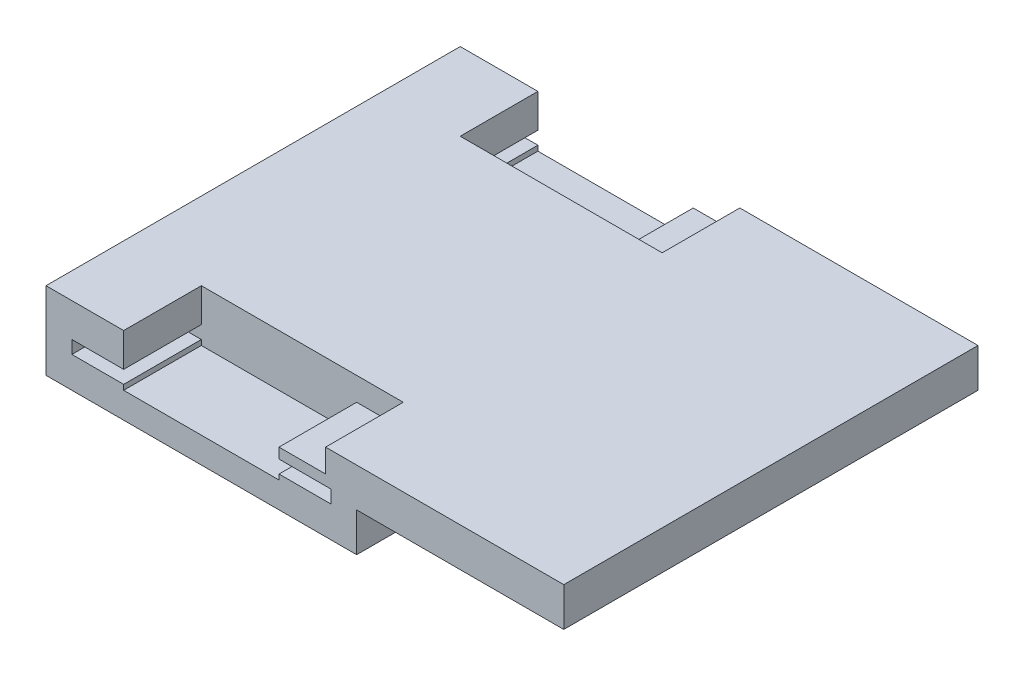
from build123d import *

# Parameters (mm, degrees)
SKETCH1_W               = 320
SKETCH1_H               = 160
BOSS_EXTRUDE1_DEPTH     = 20
SKETCH2_W               = 60
SKETCH2_H               = 30
CUT_EXTRUDE1_DEPTH      = 28
SKETCH3_W               = 20
SKETCH3_H               = 5
CUT_EXTRUDE3_DEPTH      = 30
MIRROR3_COPY_1_SKETCH_W = 60
MIRROR3_COPY_1_SKETCH_H = 30
MIRROR3_COPY_1_DEPTH    = 28
MIRROR3_COPY_2_SKETCH_W = 20
MIRROR3_COPY_2_SKETCH_H = 5
MIRROR3_COPY_2_DEPTH    = 30
SKETCH8_W               = 18
SKETCH8_H               = 9
CUT_EXTRUDE6_DEPTH      = 30
SKETCH9_W               = 18
SKETCH9_H               = 9
CUT_EXTRUDE7_DEPTH      = 30
SKETCH10_W              = 320
SKETCH10_H              = 160
BOSS_EXTRUDE2_DEPTH     = 10
CUT_EXTRUDE8_DEPTH      = 238


with BuildPart() as part:
    # Sketch1 → Boss-Extrude1 (new body)
    with BuildSketch(Plane(origin=(0, 0, 0), x_dir=(1, 0, 0), z_dir=(0, 1, 0))):
        Rectangle(SKETCH1_W, SKETCH1_H)
    extrude(amount=BOSS_EXTRUDE1_DEPTH)

    # Sketch2 → Cut-Extrude1 (cut)
    with BuildSketch(Plane(origin=(0, 20, 0), x_dir=(1, 0, 0), z_dir=(0, 1, 0))):
        with Locations((-100, -65)):
            Rectangle(SKETCH2_W, SKETCH2_H)
    cut_extrude1 = extrude(amount=-CUT_EXTRUDE1_DEPTH, mode=Mode.SUBTRACT)

    # Sketch3 → Cut-Extrude3 (cut)
    with BuildSketch(Plane.XY.offset(80)):
        with Locations((-140, 4.5)):
            Rectangle(SKETCH3_W, SKETCH3_H)
        with Locations((-60, 4.5)):
            Rectangle(SKETCH3_W, SKETCH3_H)
    cut_extrude3 = extrude(amount=-CUT_EXTRUDE3_DEPTH, mode=Mode.SUBTRACT)

    # Mirror2: Cut-Extrude1, Cut-Extrude3 across plane
    add(cut_extrude1.mirror(Plane(origin=(0, 0, 0), x_dir=(0, 0, 1), z_dir=(1, 0, 0))), mode=Mode.SUBTRACT)
    add(cut_extrude3.mirror(Plane(origin=(0, 0, 0), x_dir=(0, 0, 1), z_dir=(1, 0, 0))), mode=Mode.SUBTRACT)

    # Mirror3: Cut-Extrude1, Cut-Extrude3 across plane
    add(cut_extrude1.mirror(Plane.XY), mode=Mode.SUBTRACT)
    add(cut_extrude3.mirror(Plane.XY), mode=Mode.SUBTRACT)

    # Mirror3 copy 1 sketch → Mirror3 copy 1 (cut)
    with BuildSketch(Plane(origin=(0, 20, 0), x_dir=(-1, 0, 0), z_dir=(0, 1, 0))):
        with Locations((-100, -65)):
            Rectangle(MIRROR3_COPY_1_SKETCH_W, MIRROR3_COPY_1_SKETCH_H)
    extrude(amount=-MIRROR3_COPY_1_DEPTH, mode=Mode.SUBTRACT)

    # Mirror3 copy 2 sketch → Mirror3 copy 2 (cut)
    with BuildSketch(Plane(origin=(0, 0, -80), x_dir=(-1, 0, 0), z_dir=(0, 0, -1))):
        with Locations((-140, 4.5)):
            Rectangle(MIRROR3_COPY_2_SKETCH_W, MIRROR3_COPY_2_SKETCH_H)
        with Locations((-60, 4.5)):
            Rectangle(MIRROR3_COPY_2_SKETCH_W, MIRROR3_COPY_2_SKETCH_H)
    extrude(amount=-MIRROR3_COPY_2_DEPTH, mode=Mode.SUBTRACT)

    # Sketch8 → Cut-Extrude6 (cut)
    with BuildSketch(Plane(origin=(0, 0, -80), x_dir=(-1, 0, 0), z_dir=(0, 0, -1))):
        with Locations((-139, 15.5)):
            Rectangle(SKETCH8_W, SKETCH8_H)
    cut_extrude6 = extrude(amount=-CUT_EXTRUDE6_DEPTH, mode=Mode.SUBTRACT)

    # Sketch9 → Cut-Extrude7 (cut)
    with BuildSketch(Plane(origin=(0, 0, -80), x_dir=(-1, 0, 0), z_dir=(0, 0, -1))):
        with Locations((61, 15.5)):
            Rectangle(SKETCH9_W, SKETCH9_H)
    cut_extrude7 = extrude(amount=-CUT_EXTRUDE7_DEPTH, mode=Mode.SUBTRACT)

    # Sketch10 → Boss-Extrude2 (add)
    with BuildSketch(Plane.XZ):
        Rectangle(SKETCH10_W, SKETCH10_H)
    extrude(amount=BOSS_EXTRUDE2_DEPTH)

    # Mirror4: Cut-Extrude6, Cut-Extrude7 across plane
    add(cut_extrude6.mirror(Plane.XY), mode=Mode.SUBTRACT)
    add(cut_extrude7.mirror(Plane.XY), mode=Mode.SUBTRACT)

    # Sketch11 → Cut-Extrude8 (cut)
    with BuildSketch(Plane(origin=(0, 0, -80), x_dir=(-1, 0, 0), z_dir=(0, 0, -1))):
        Polygon((-40, 20), (-40, 5), (40, 5), (40, -10), (-160, -10), (-160, 20), align=None)
    extrude(amount=-CUT_EXTRUDE8_DEPTH, mode=Mode.SUBTRACT)


solid = part.part
